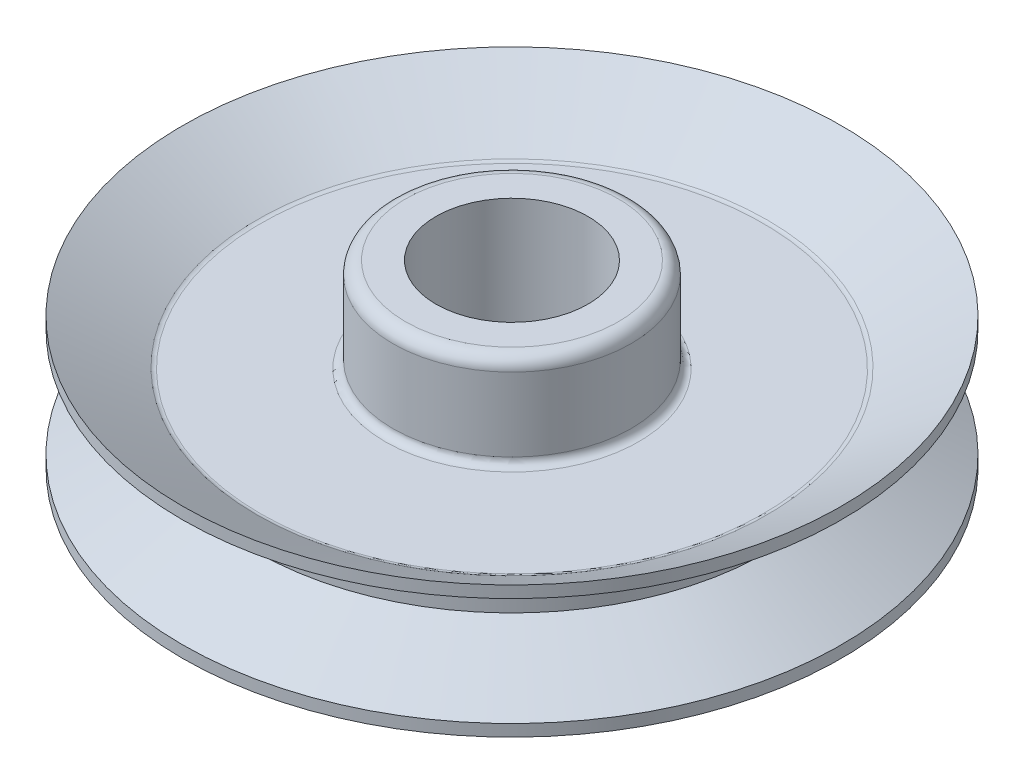
from build123d import *

# Parameters (mm, degrees)
SKETCH2_R           = 4.7
SKETCH2_R_2         = 3
BOSS_EXTRUDE1_DEPTH = 3.7
SKETCH3_R           = 3
CUT_EXTRUDE1_DEPTH  = 19.753399692
FILLET1_R           = 0.5
FILLET2_R           = 0.3


with BuildPart() as part:
    # Sketch1 → Revolve1 (revolve)
    with BuildSketch(Plane(origin=(0, 0, 0), x_dir=(0, 0, -1), z_dir=(1, 0, 0))):
        Polygon((-13, -2.35), (-13, -1.883523848), (-10.110793586, -0.15), (-10.110793586, 0.65), (-13, 2.383523848), (-13, 2.85), (-10, 1.05), (0, 1.05), (0, -0.55), (-10, -0.55), align=None)
    revolve(axis=Axis((0, 0, 0), (0, -1, 0)))

    # Sketch2 → Boss-Extrude1 (add)
    with BuildSketch(Plane(origin=(0, 1.05, 0), x_dir=(1, 0, 0), z_dir=(0, 1, 0))):
        with Locations(Location((0, 0, 0), (0, 0, 270))):
            Circle(SKETCH2_R)
        with Locations(Location((0, 0, 0), (0, 0, 270))):
            Circle(SKETCH2_R_2, mode=Mode.SUBTRACT)
    boss_extrude1 = extrude(amount=BOSS_EXTRUDE1_DEPTH)

    # Sketch3 → Cut-Extrude1 (cut, through all)
    with BuildSketch(Plane(origin=(0, 1.05, 0), x_dir=(1, 0, 0), z_dir=(0, 1, 0))):
        with Locations(Location((0, 0, 0), (0, 0, 90))):
            Circle(SKETCH3_R)
    extrude(amount=-CUT_EXTRUDE1_DEPTH, mode=Mode.SUBTRACT)

    # Mirror1: Boss-Extrude1 across plane
    add(boss_extrude1.mirror(Plane.ZX.offset(0.25)))

    # Fillet1
    fillet1_edges = [part.edges().sort_by_distance(p)[0] for p in [
        (0, 4.75, -4.7),
        (0, -4.25, -4.7),
    ]]
    fillet(fillet1_edges, radius=FILLET1_R)

    # Fillet2
    fillet2_edges = [part.edges().sort_by_distance(p)[0] for p in [
        (0, 1.05, -4.7),
        (0, -0.55, -4.7),
        (0, 1.05, -10),
        (0, -0.55, -10),
    ]]
    fillet(fillet2_edges, radius=FILLET2_R)


solid = part.part
